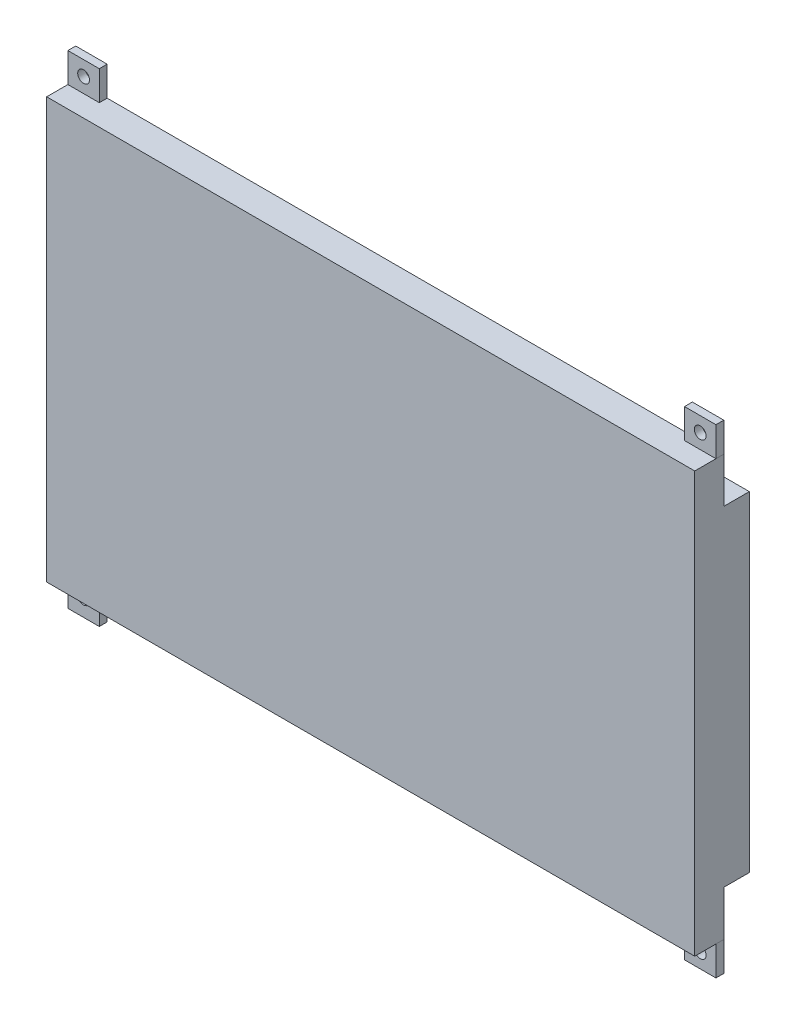
from build123d import *

# Parameters (mm, degrees)
SKETCH1_W             = 165
SKETCH1_H             = 107
BOSS_EXTRUDE1_DEPTH   = 7.4
SKETCH2_W             = 8
SKETCH2_H             = 7.5
SKETCH2_R             = 1.5
BOSS_EXTRUDE2_DEPTH   = 2
BOSS_EXTRUDE2_2_DEPTH = 2
SKETCH2_H_2           = 8.5
BOSS_EXTRUDE2_3_DEPTH = 2
BOSS_EXTRUDE2_4_DEPTH = 2
SKETCH3_W             = 165
SKETCH3_H             = 84
BOSS_EXTRUDE3_DEPTH   = 6.5


with BuildPart() as part:
    # Sketch1 → Boss-Extrude1 (new body)
    with BuildSketch(Plane.XY):
        Rectangle(SKETCH1_W, SKETCH1_H)
    extrude(amount=BOSS_EXTRUDE1_DEPTH)

    # Sketch3 → Boss-Extrude3 (add)
    with BuildSketch(Plane(origin=(0, 0, 0), x_dir=(-1, 0, 0), z_dir=(0, 0, -1))):
        Rectangle(SKETCH3_W, SKETCH3_H)
    extrude(amount=BOSS_EXTRUDE3_DEPTH)


with BuildPart() as body_2:
    # Sketch2 → Boss-Extrude2 (new body)
    with BuildSketch(Plane(origin=(0, 0, 0), x_dir=(-1, 0, 0), z_dir=(0, 0, -1))):
        with Locations((-78.5, 57.25)):
            Rectangle(SKETCH2_W, SKETCH2_H)
        with Locations((-78.5, 57.25)):
            Circle(SKETCH2_R, mode=Mode.SUBTRACT)
    extrude(amount=-BOSS_EXTRUDE2_DEPTH)


with BuildPart() as body_3:
    # Sketch2 → Boss-Extrude2 2 (new body)
    with BuildSketch(Plane(origin=(0, 0, 0), x_dir=(-1, 0, 0), z_dir=(0, 0, -1))):
        with Locations((78.5, 57.25)):
            Rectangle(SKETCH2_W, SKETCH2_H)
        with Locations((78.5, 57.25)):
            Circle(SKETCH2_R, mode=Mode.SUBTRACT)
    extrude(amount=-BOSS_EXTRUDE2_2_DEPTH)


with BuildPart() as body_4:
    # Sketch2 → Boss-Extrude2 3 (new body)
    with BuildSketch(Plane(origin=(0, 0, 0), x_dir=(-1, 0, 0), z_dir=(0, 0, -1))):
        with Locations((78.5, -57.75)):
            Rectangle(SKETCH2_W, SKETCH2_H_2)
        with Locations((78.5, -57.75)):
            Circle(SKETCH2_R, mode=Mode.SUBTRACT)
    extrude(amount=-BOSS_EXTRUDE2_3_DEPTH)


with BuildPart() as body_5:
    # Sketch2 → Boss-Extrude2 4 (new body)
    with BuildSketch(Plane(origin=(0, 0, 0), x_dir=(-1, 0, 0), z_dir=(0, 0, -1))):
        with Locations((-78.5, -57.25)):
            Rectangle(SKETCH2_W, SKETCH2_H)
        with Locations((-78.5, -57.25)):
            Circle(SKETCH2_R, mode=Mode.SUBTRACT)
    extrude(amount=-BOSS_EXTRUDE2_4_DEPTH)


solid = Compound([part.part, body_2.part, body_3.part, body_4.part, body_5.part])
